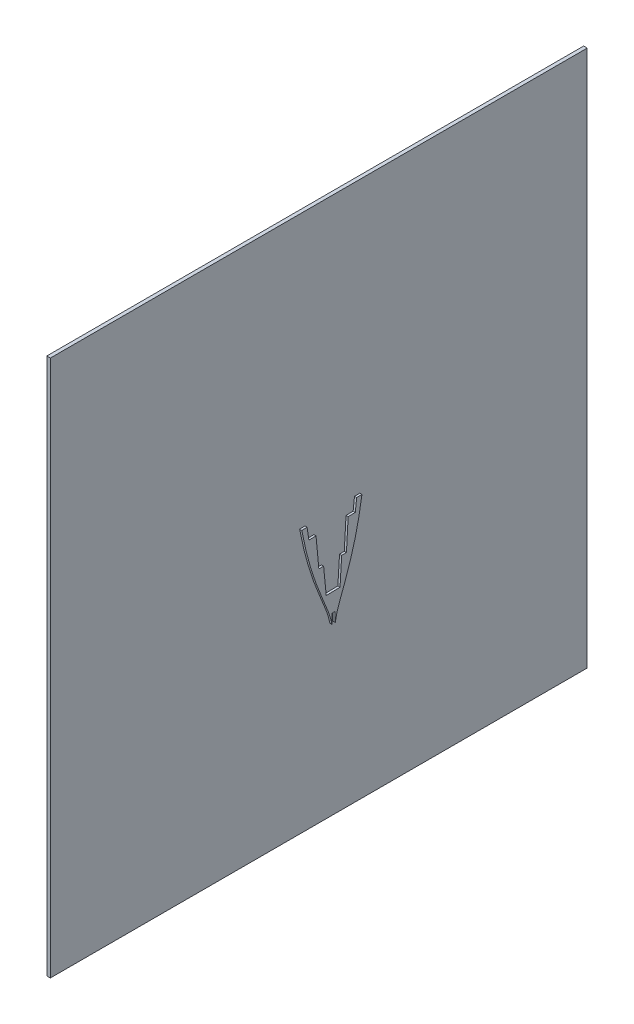
from build123d import *

# Parameters (mm, degrees)
BOSS_EXTRU_2_DEPTH      = 10
BOSS_EXTRU_3_DEPTH      = 6
ENL_V_MAT_EXTRU_1_DEPTH = 6


with BuildPart() as part:
    # Esquisse3D1 → Boss.-Extru.2 (new body)
    with BuildSketch(Plane(origin=(-20, 1121.289346724, 777.274991403), x_dir=(0, -0.7071067811865476, -0.7071067811865476), z_dir=(1, 0, 0))):
        Polygon((0, 0), (1060.66017178, 1060.66017178), (2121.32034356, 0), (1060.66017178, -1060.66017178), align=None)
    extrude(amount=BOSS_EXTRU_2_DEPTH)


with BuildPart() as body_2:
    # Esquisse5 → Boss.-Extru.3 (new body)
    with BuildSketch(Plane(origin=(0, 0, 0), x_dir=(0, 0, -1), z_dir=(1, 0, 0))):
        with BuildLine():
            Line((77.287344643, 372.1228469), (62.515163388, 371.855243264))
            Line((62.515163388, 371.855243264), (58.703617713, 337.907916837))
            Line((58.703617713, 337.907916837), (38.792184843, 337.547213718))
            Line((38.792184843, 337.547213718), (33.955431891, 253.236366537))
            Line((33.955431891, 253.236366537), (20.657141386, 252.995462988))
            Line((20.657141386, 252.995462988), (16.043473159, 178.148864034))
            Line((16.043473159, 178.148864034), (-22.485297051, 177.450900827))
            Line((-22.485297051, 177.450900827), (-29.806797304, 252.081289701))
            Line((-29.806797304, 252.081289701), (-43.105087809, 251.840386152))
            Line((-43.105087809, 251.840386152), (-50.99231078, 335.920733708))
            Line((-50.99231078, 335.920733708), (-70.903743651, 335.56003059))
            Line((-70.903743651, 335.56003059), (-75.942322258, 369.347033677))
            Line((-75.942322258, 369.347033677), (-90.714503513, 369.079430041))
            add(Edge.make_bspline(
                [(0, 0), (-2.231920332, 123.205843338), (-2.246571286, 124.014601197), (-57.02679385, 186.485173332), (-90.714503513, 369.079430041)],
                knots=[0, 0, 0, 0, 0, 1, 1, 1, 1, 1], degree=4))
            add(Edge.make_bspline(
                [(0, 0), (-2.231920332, 123.205843338), (-2.246571286, 124.014601197), (50.235095514, 188.428262923), (77.287344643, 372.1228469)],
                knots=[0, 0, 0, 0, 0, 1, 1, 1, 1, 1], degree=4))
        make_face()
    extrude(amount=BOSS_EXTRU_3_DEPTH)

    # Esquisse6 → Enlèv. mat.-Extru.1 (cut)
    with BuildSketch(Plane(origin=(6, 0, 0), x_dir=(0, 0, -1), z_dir=(1, 0, 0))):
        Polygon((-6.300645255, 99.317197706), (-6.789760441, 126.317197706), (2.210239559, 126.480236102), (2.699354745, 99.480236102), (117.063261114, -47.52702125), (-85.227699586, -65.220017949), align=None)
    extrude(amount=-ENL_V_MAT_EXTRU_1_DEPTH, mode=Mode.SUBTRACT)


solid = Compound([part.part, body_2.part])
